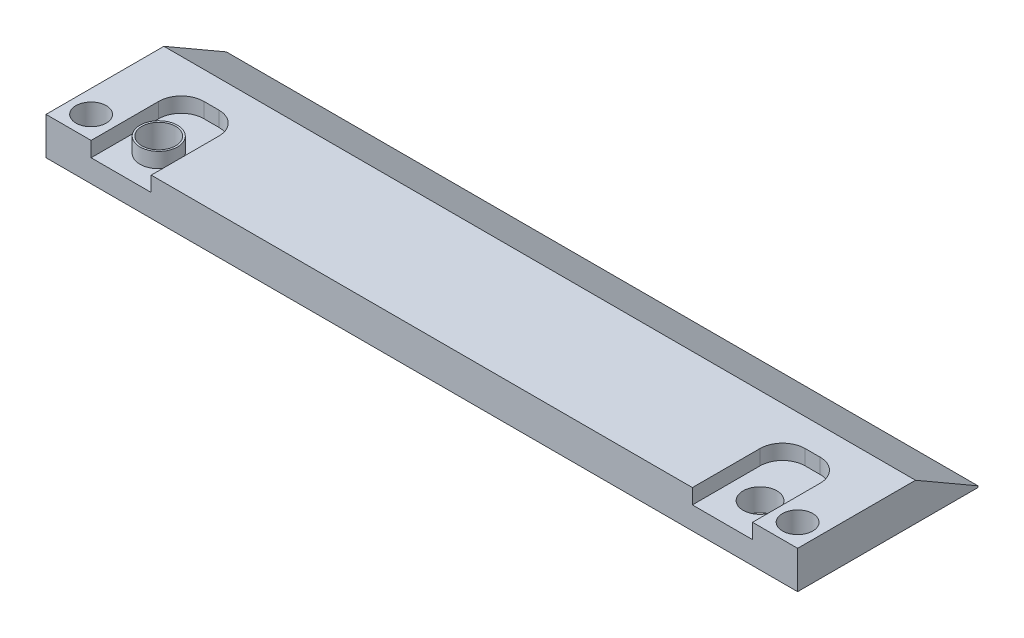
from build123d import *

# Parameters (mm, degrees)
CROQUIS1_W              = 100
CROQUIS1_H              = 24
CROQUIS1_R              = 2.017504942
CROQUIS1_R_2            = 2.25
SALIENTE_EXTRUIR1_DEPTH = 5
CROQUIS2_R              = 2.5
CORTAR_EXTRUIR1_DEPTH   = 2
CORTAR_EXTRUIR5_DEPTH   = 141


with BuildPart() as part:
    # Croquis1 → Saliente-Extruir1 (new body)
    with BuildSketch(Plane(origin=(0, 0, 0), x_dir=(1, 0, 0), z_dir=(0, 1, 0))):
        Rectangle(CROQUIS1_W, CROQUIS1_H)
        with Locations(Location((-47, -9, 0), (0, 0, 270))):
            Circle(CROQUIS1_R, mode=Mode.SUBTRACT)
        with Locations(Location((-40, -7, 0), (0, 0, 270))):
            Circle(CROQUIS1_R_2, mode=Mode.SUBTRACT)
        with Locations(Location((40, -7, 0), (0, 0, 270))):
            Circle(CROQUIS1_R_2, mode=Mode.SUBTRACT)
        with Locations(Location((47, -9, 0), (0, 0, 270))):
            Circle(CROQUIS1_R, mode=Mode.SUBTRACT)
    extrude(amount=SALIENTE_EXTRUIR1_DEPTH)

    # Croquis2 → Cortar-Extruir1 (cut)
    # profile 1 of 2: a face of its own
    with BuildSketch(Plane(origin=(0, 5, 0), x_dir=(1, 0, 0), z_dir=(0, 1, 0))):
        with BuildLine():
            Line((-44, -3), (-44, -12))
            Line((-44, -12), (-36, -12))
            Line((-36, -12), (-36, -3))
            ThreePointArc((-36, -3), (-36.878679656, -0.878679656), (-39, 0))
            Line((-39, 0), (-41, 0))
            ThreePointArc((-41, 0), (-43.121320344, -0.878679656), (-44, -3))
        make_face()
        with Locations(Location((-40, -7, 0), (0, 0, 270))):
            Circle(CROQUIS2_R, mode=Mode.SUBTRACT)
    # profile 2 of 2: a face of its own
    with BuildSketch(Plane(origin=(0, 5, 0), x_dir=(1, 0, 0), z_dir=(0, 1, 0))):
        with BuildLine():
            Line((41, 0), (39, 0))
            ThreePointArc((39, 0), (36.878679656, -0.878679656), (36, -3))
            Line((36, -3), (36, -12))
            Line((36, -12), (44, -12))
            Line((44, -12), (44, -3))
            ThreePointArc((44, -3), (43.121320344, -0.878679656), (41, 0))
        make_face()
    extrude(amount=-CORTAR_EXTRUIR1_DEPTH, mode=Mode.SUBTRACT)

    # Croquis3 → Cortar-Extruir5 (cut)
    with BuildSketch(Plane.ZY.offset(50)):
        Polygon((-12, 5), (-12, 0.2), (-6.100895765, 3.605849418), (-3.686156124, 5), align=None)
        Polygon((-12.757171087, 0.2), (-12, 0.2), (-12, 5), (-3.686156124, 5), (-3.039853353, 5.373143079), (-12.757171087, 5.373143079), align=None)
    extrude(amount=-CORTAR_EXTRUIR5_DEPTH, mode=Mode.SUBTRACT)


solid = part.part
